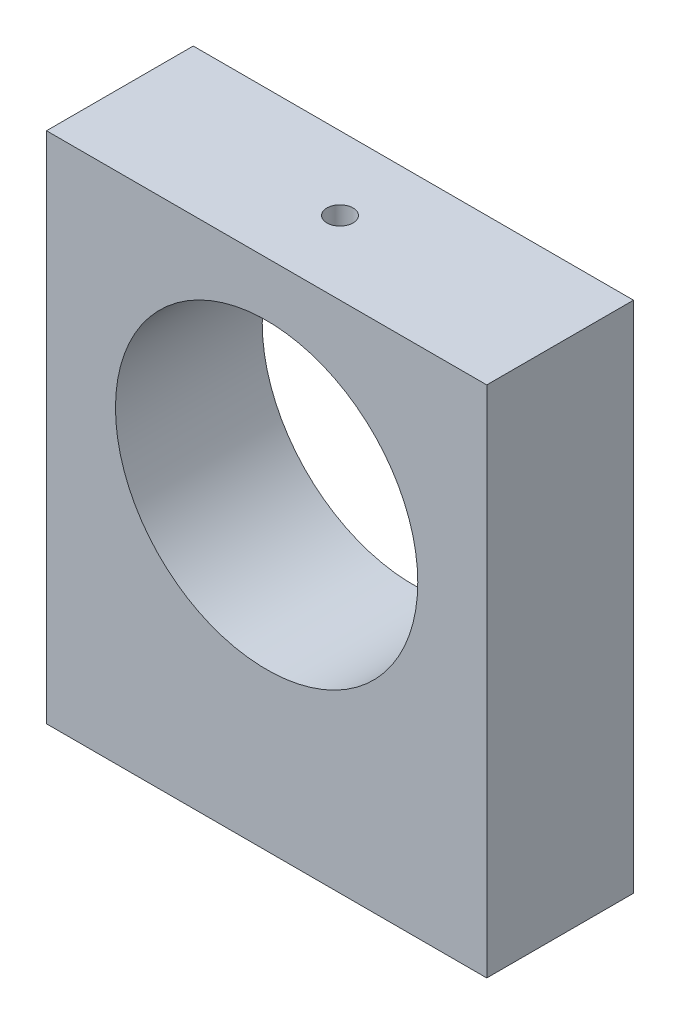
from build123d import *

# Parameters (mm, degrees)
SKETCH1_W                  = 38.1
SKETCH1_H                  = 44.45
SKETCH1_R                  = 13.081
BOSS_EXTRUDE1_DEPTH        = 12.7
F_4_40_TAPPED_HOLE1_D      = 2.2606
F_4_40_TAPPED_HOLE1_DEPTH  = 17.779
F_4_40_TAPPED_HOLE1_TIP    = 0.679152758
F_10_32_TAPPED_HOLE1_D     = 4.0386
F_10_32_TAPPED_HOLE1_DEPTH = 12.7
F_10_32_TAPPED_HOLE1_TIP   = 1.213317848


with BuildPart() as part:
    # Sketch1 → Boss-Extrude1 (new body)
    with BuildSketch(Plane.XY):
        with Locations((0, 22.225)):
            Rectangle(SKETCH1_W, SKETCH1_H)
        with Locations((0, 26.67)):
            Circle(SKETCH1_R, mode=Mode.SUBTRACT)
    extrude(amount=BOSS_EXTRUDE1_DEPTH)

    # #4-40 Tapped Hole1
    with Locations(Plane(origin=(0, 44.45, 0), x_dir=(-1, 0, 0), z_dir=(0, 1, 0))):
        with Locations((0, 6.35)):
            Hole(F_4_40_TAPPED_HOLE1_D / 2, depth=F_4_40_TAPPED_HOLE1_DEPTH)
            with Locations((0, 0, -(F_4_40_TAPPED_HOLE1_DEPTH + F_4_40_TAPPED_HOLE1_TIP / 2))):  # 118° drill point
                Cone(0, F_4_40_TAPPED_HOLE1_D / 2, F_4_40_TAPPED_HOLE1_TIP, mode=Mode.SUBTRACT)

    # #10-32 Tapped Hole1
    with Locations(Plane.XZ):
        with Locations((-12.7, 6.35), (12.7, 6.35)):
            Hole(F_10_32_TAPPED_HOLE1_D / 2, depth=F_10_32_TAPPED_HOLE1_DEPTH)
            with Locations((0, 0, -(F_10_32_TAPPED_HOLE1_DEPTH + F_10_32_TAPPED_HOLE1_TIP / 2))):  # 118° drill point
                Cone(0, F_10_32_TAPPED_HOLE1_D / 2, F_10_32_TAPPED_HOLE1_TIP, mode=Mode.SUBTRACT)


solid = part.part
